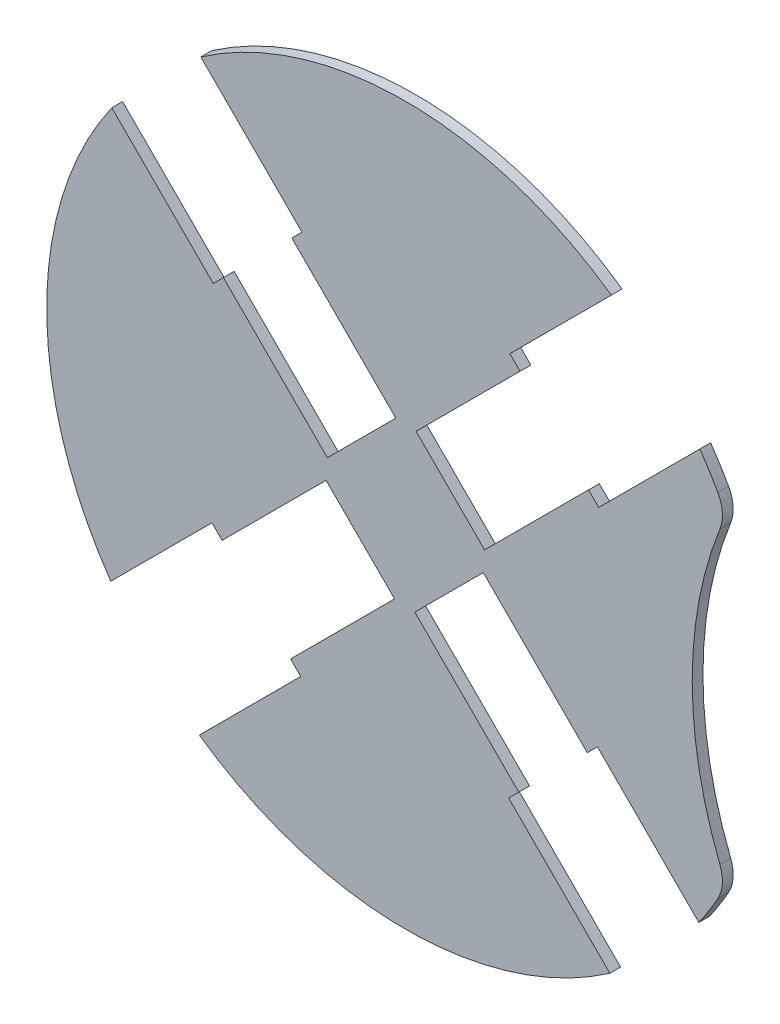
from build123d import *

# Parameters (mm, degrees)
CROQUIS1_R              = 100
SALIENTE_EXTRUIR1_DEPTH = 3
CROQUIS3_R              = 110
CORTAR_EXTRUIR1_DEPTH   = 3
REDONDEO1_R             = 10
CORTAR_EXTRUIR2_DEPTH   = 142.453172607


with BuildPart() as part:
    # Croquis1 → Saliente-Extruir1 (new body)
    with BuildSketch(Plane.XY):
        Circle(CROQUIS1_R)
    extrude(amount=SALIENTE_EXTRUIR1_DEPTH)

    # Croquis3 → Cortar-Extruir1 (cut)
    with BuildSketch(Plane.XY.offset(3)):
        with Locations((190, 0)):
            Circle(CROQUIS3_R)
    extrude(amount=-CORTAR_EXTRUIR1_DEPTH, mode=Mode.SUBTRACT)

    # Redondeo1
    redondeo1_edges = [part.edges().sort_by_distance(p)[0] for p in [
        (89.473684211, -44.659375654, 1.5),
        (89.473684211, 44.659375654, 1.5),
    ]]
    fillet(redondeo1_edges, radius=REDONDEO1_R)

    # Croquis4 → Cortar-Extruir2 (cut, through all)
    with BuildSketch(Plane.XY.offset(3)):
        Polygon((-58.513086143, -82.908270094), (-83.261823485, -58.159532753), (-53.916892065, -28.814601333), (-51.088464941, -31.643028458), (-22.097086912, -2.651650429), (-3.00520382, -21.743533521), (-31.996581849, -50.73491155), (-29.168154724, -53.563338675), align=None)
        Polygon((-82.908270094, 58.513086143), (-53.563338675, 29.168154724), (-50.73491155, 31.996581849), (-21.743533521, 3.00520382), (-2.651650429, 22.097086912), (-31.643028458, 51.088464941), (-28.814601333, 53.916892065), (-58.159532753, 83.261823485), align=None)
        Polygon((58.513086143, 82.908270094), (29.168154724, 53.563338675), (31.996581849, 50.73491155), (3.00520382, 21.743533521), (22.097086912, 2.651650429), (51.088464941, 31.643028458), (53.916892065, 28.814601333), (83.261823485, 58.159532753), align=None)
        Polygon((82.908270094, -58.513086143), (53.563338675, -29.168154724), (50.73491155, -31.996581849), (21.743533521, -3.00520382), (2.651650429, -22.097086912), (31.643028458, -51.088464941), (28.814601333, -53.916892065), (58.159532753, -83.261823485), align=None)
    extrude(amount=-CORTAR_EXTRUIR2_DEPTH, mode=Mode.SUBTRACT)


solid = part.part
